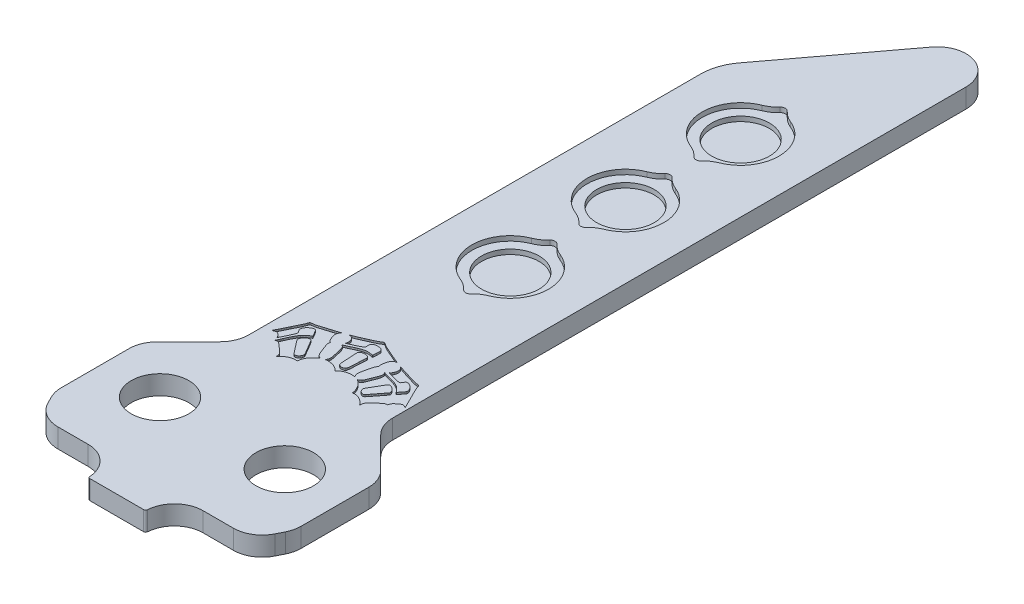
from build123d import *
from OCP.BRepFilletAPI import BRepFilletAPI_MakeFillet

# Parameters (mm, degrees)
BOSS_EXTRUDE1_DEPTH     = 1
CUT_EXTRUDE2_DEPTH      = 91.869411795
CUT_EXTRUDE2_DEPTH_BACK = 91.869411795
SKETCH2_R               = 3
SKETCH4_R               = 3
CUT_EXTRUDE4_DEPTH      = 91.869411795
CUT_EXTRUDE5_START      = 0.5
SKETCH4_3_R             = 4
SKETCH4_3_R_2           = 3
CUT_EXTRUDE5_DEPTH      = 0.5
FILLET7_R               = 0.5
LPATTERN2_COUNT         = 3
LPATTERN2_PITCH         = 12
FILLET7_OF_LPATTERN2_R  = 0.5
FILLET2_R               = 3
FILLET3_R1              = 5
FILLET3_R2              = 3
FILLET6_R               = 0.2
FILLET1_R               = 3
CUT_EXTRUDE8_START      = 1
CUT_EXTRUDE8_DEPTH      = 0.2


with BuildPart() as part:
    # Sketch1 → Boss-Extrude1 (new, symmetric)
    with BuildSketch(Plane(origin=(0, 0, 0), x_dir=(1, 0, 0), z_dir=(0, 1, 0))):
        Polygon((-7.5, 70), (7.5, 90), (7.5, 20), (12.5, 15), (12.5, 6), (11, 3), (3, 3), (3, 0), (-3, 0), (-3, 3), (-11, 3), (-12.5, 6), (-12.5, 15), (-7.5, 20), align=None)
    extrude(amount=BOSS_EXTRUDE1_DEPTH, both=True)

    # Sketch2 → Cut-Extrude2 (cut, two sides: drawn at the far end of the back side and taken through both)
    with BuildSketch(Plane(origin=(0, 0, 0), x_dir=(1, 0, 0), z_dir=(0, 1, 0)).offset(-CUT_EXTRUDE2_DEPTH_BACK)):
        with Locations(Location((-6.5, 11, 0), (0, 0, 270))):
            Circle(SKETCH2_R)
        with Locations(Location((6.5, 11, 0), (0, 0, 270))):
            Circle(SKETCH2_R)
    extrude(amount=CUT_EXTRUDE2_DEPTH + CUT_EXTRUDE2_DEPTH_BACK, mode=Mode.SUBTRACT)

    # Sketch4 → Cut-Extrude4 (cut, through all)
    with BuildSketch(Plane(origin=(0, 0, 0), x_dir=(1, 0, 0), z_dir=(0, 1, 0))):
        with Locations(Location((0, 65, 0), (0, 0, 270))):
            Circle(SKETCH4_R)
    cut_extrude4 = extrude(amount=CUT_EXTRUDE4_DEPTH, mode=Mode.SUBTRACT)

    # Sketch4<3> → Cut-Extrude5 (cut)
    # profile 1 of 3: a face of its own
    with BuildSketch(Plane(origin=(0, 0, 0), x_dir=(1, 0, 0), z_dir=(0, 1, 0)).offset(CUT_EXTRUDE5_START)):
        with BuildLine():
            ThreePointArc((-1.484614978, 68.714285714), (0, 69), (1.484614978, 68.714285714))
            ThreePointArc((1.484614978, 68.714285714), (0.634115199, 69.232213162), (0, 70))
            ThreePointArc((0, 70), (-0.634115199, 69.232213162), (-1.484614978, 68.714285714))
        make_face()
    # profile 2 of 3: a face of its own
    with BuildSketch(Plane(origin=(0, 0, 0), x_dir=(1, 0, 0), z_dir=(0, 1, 0)).offset(CUT_EXTRUDE5_START)):
        with Locations((0, 65)):
            Circle(SKETCH4_3_R)
        with Locations(Location((0, 65, 0), (0, 0, 90))):
            Circle(SKETCH4_3_R_2, mode=Mode.SUBTRACT)
    # profile 3 of 3: a face of its own
    with BuildSketch(Plane(origin=(0, 0, 0), x_dir=(1, 0, 0), z_dir=(0, 1, 0)).offset(CUT_EXTRUDE5_START)):
        with BuildLine():
            ThreePointArc((0, 60), (0.634115199, 60.767786838), (1.484614978, 61.285714286))
            ThreePointArc((1.484614978, 61.285714286), (0, 61), (-1.484614978, 61.285714286))
            ThreePointArc((-1.484614978, 61.285714286), (-0.634115199, 60.767786838), (0, 60))
        make_face()
    cut_extrude5 = extrude(amount=CUT_EXTRUDE5_DEPTH, mode=Mode.SUBTRACT)

    # Fillet7
    fillet7_edges = [part.edges().sort_by_distance(p)[0] for p in [
        (0, 0.75, -60),
        (0, 0.75, -70),
    ]]
    fillet(fillet7_edges, radius=FILLET7_R)

    # LPattern2: Cut-Extrude4, Cut-Extrude5 ×3
    with Locations(*[(0, 0, i * LPATTERN2_PITCH) for i in range(1, LPATTERN2_COUNT)]):
        add(cut_extrude4, mode=Mode.SUBTRACT)
        add(cut_extrude5, mode=Mode.SUBTRACT)

    # Fillet7 of LPattern2
    fillet7_of_lpattern2_edges = [part.edges().sort_by_distance(p)[0] for p in [
        (0, 0.75, -48),
        (0, 0.75, -58),
        (0, 0.75, -36),
        (0, 0.75, -46),
    ]]
    fillet(fillet7_of_lpattern2_edges, radius=FILLET7_OF_LPATTERN2_R)

    # Fillet2
    fillet2_edges = [part.edges().sort_by_distance(p)[0] for p in [
        (-7.5, 0, -20),
        (-12.5, 0, -15),
        (-12.5, 0, -6),
        (-11, 0, -3),
        (11, 0, -3),
        (12.5, 0, -6),
        (12.5, 0, -15),
        (7.5, 0, -20),
    ]]
    fillet(fillet2_edges, radius=FILLET2_R)

    # Fillet3: one fillet with a radius per group of edges: ONE call of the kernel's fillet builder (fillet() takes one radius for all edges)
    fillet3_edges_1 = [part.edges().sort_by_distance(p)[0] for p in [
        (-7.5, 0, -70),
    ]]
    fillet3_edges_2 = [part.edges().sort_by_distance(p)[0] for p in [
        (7.5, 0, -90),
    ]]
    fillet3 = BRepFilletAPI_MakeFillet(part.part.solid().wrapped)
    for e in fillet3_edges_1:
        fillet3.Add(FILLET3_R1, e.wrapped)
    for e in fillet3_edges_2:
        fillet3.Add(FILLET3_R2, e.wrapped)
    add(Compound.cast(fillet3.Shape()), mode=Mode.REPLACE)

    # Fillet6
    fillet6_edges = [part.edges().sort_by_distance(p)[0] for p in [
        (-3, 0, 0),
        (3, 0, 0),
    ]]
    fillet(fillet6_edges, radius=FILLET6_R)

    # Fillet1
    fillet1_edges = [part.edges().sort_by_distance(p)[0] for p in [
        (3, 0, -3),
        (-3, 0, -3),
    ]]
    fillet(fillet1_edges, radius=FILLET1_R)

    # Sketch9 → Cut-Extrude8 (cut)
    # profile 1 of 3: a face of its own
    with BuildSketch(Plane(origin=(0, 0, 0), x_dir=(1, 0, 0), z_dir=(0, 1, 0)).offset(CUT_EXTRUDE8_START)):
        with BuildLine():
            Line((2.090466235, 25.090971751), (2.155619575, 25.14832202))
            Line((2.155619575, 25.14832202), (2.125319858, 25.227637184))
            ThreePointArc((2.125319858, 25.227637184), (2.108063654, 25.280121783), (2.095837376, 25.33400061))
            ThreePointArc((2.095837376, 25.33400061), (2.088453235, 25.389881035), (2.086065745, 25.44619664))
            ThreePointArc((2.086065745, 25.44619664), (2.088571699, 25.512961864), (2.095791646, 25.57938285))
            ThreePointArc((2.095791646, 25.57938285), (2.109744606, 25.666111982), (2.126441077, 25.752354984))
            ThreePointArc((2.126441077, 25.752354984), (2.151926483, 25.866926225), (2.180105336, 25.980864926))
            ThreePointArc((2.180105336, 25.980864926), (2.203288472, 26.059156543), (2.231683915, 26.135711973))
            ThreePointArc((2.231683915, 26.135711973), (2.258454025, 26.193078634), (2.290575685, 26.247629268))
            ThreePointArc((2.290575685, 26.247629268), (2.325377942, 26.294227478), (2.365637112, 26.336201153))
            ThreePointArc((2.365637112, 26.336201153), (2.395135103, 26.360757887), (2.426957585, 26.382217017))
            ThreePointArc((2.426957585, 26.382217017), (2.465217448, 26.403556735), (2.504840473, 26.422244074))
            ThreePointArc((2.504840473, 26.422244074), (2.547060992, 26.438788871), (2.590285549, 26.452498003))
            ThreePointArc((2.590285549, 26.452498003), (2.632060498, 26.462497008), (2.674487782, 26.469209095))
            ThreePointArc((2.674487782, 26.469209095), (2.687668032, 26.47098806), (2.700783406, 26.473195011))
            ThreePointArc((2.700783406, 26.473195011), (2.710934905, 26.475428921), (2.720913379, 26.478339822))
            ThreePointArc((2.720913379, 26.478339822), (2.72701009, 26.480716259), (2.732813837, 26.483738486))
            ThreePointArc((2.732813837, 26.483738486), (2.734276698, 26.486011331), (2.733331314, 26.488543531))
            ThreePointArc((2.733331314, 26.488543531), (2.728519983, 26.492274427), (2.723122412, 26.495091289))
            ThreePointArc((2.723122412, 26.495091289), (2.68159768, 26.512202202), (2.640044464, 26.529243827))
            ThreePointArc((2.640044464, 26.529243827), (2.592090458, 26.548708022), (2.544028743, 26.567904717))
            ThreePointArc((2.544028743, 26.567904717), (2.488218008, 26.589900618), (2.432328711, 26.611696128))
            ThreePointArc((2.432328711, 26.611696128), (2.366115376, 26.637688485), (2.300113739, 26.664213801))
            ThreePointArc((2.300113739, 26.664213801), (2.220305945, 26.696873908), (2.140647779, 26.729897279))
            ThreePointArc((2.140647779, 26.729897279), (2.060454505, 26.763570962), (1.98041514, 26.797608853))
            ThreePointArc((1.98041514, 26.797608853), (1.912841147, 26.826826106), (1.845487111, 26.85654691))
            ThreePointArc((1.845487111, 26.85654691), (1.750581944, 26.898757861), (1.655609362, 26.940816909))
            ThreePointArc((1.655609362, 26.940816909), (1.580192816, 26.974000628), (1.504671458, 27.006945111))
            ThreePointArc((1.504671458, 27.006945111), (1.422561779, 27.042474632), (1.340354563, 27.077777889))
            ThreePointArc((1.340354563, 27.077777889), (1.220391923, 27.129033717), (1.10038177, 27.180178198))
            ThreePointArc((1.10038177, 27.180178198), (1.01118139, 27.219427085), (0.922958384, 27.260826167))
            ThreePointArc((0.922958384, 27.260826167), (0.828233733, 27.307800114), (0.734418017, 27.356564063))
            ThreePointArc((0.734418017, 27.356564063), (0.648206754, 27.403486316), (0.56291133, 27.45205349))
            ThreePointArc((0.56291133, 27.45205349), (0.501971734, 27.48952566), (0.44290856, 27.529890737))
            ThreePointArc((0.44290856, 27.529890737), (0.390416705, 27.565509082), (0.336050705, 27.598195461))
            ThreePointArc((0.336050705, 27.598195461), (0.301378991, 27.6126537), (0.264278159, 27.618544091))
            ThreePointArc((0.264278159, 27.618544091), (0.228226109, 27.615300282), (0.194179563, 27.603007797))
            ThreePointArc((0.194179563, 27.603007797), (0.143771864, 27.574863602), (0.09541553, 27.543324788))
            ThreePointArc((0.09541553, 27.543324788), (0.033826722, 27.502559175), (-0.02991695, 27.465252864))
            ThreePointArc((-0.02991695, 27.465252864), (-0.135269641, 27.408397179), (-0.241411713, 27.353029149))
            ThreePointArc((-0.241411713, 27.353029149), (-0.356270729, 27.295221157), (-0.471983333, 27.239141299))
            ThreePointArc((-0.471983333, 27.239141299), (-0.572873227, 27.19260055), (-0.67481407, 27.148409191))
            ThreePointArc((-0.67481407, 27.148409191), (-0.719503542, 27.129462001), (-0.764057904, 27.110199245))
            ThreePointArc((-0.764057904, 27.110199245), (-0.824097654, 27.083884012), (-0.884059778, 27.057392377))
            ThreePointArc((-0.884059778, 27.057392377), (-0.948210285, 27.028825839), (-1.01227745, 27.000072873))
            ThreePointArc((-1.01227745, 27.000072873), (-1.070997047, 26.973484395), (-1.12961631, 26.946675437))
            ThreePointArc((-1.12961631, 26.946675437), (-1.249841669, 26.89200233), (-1.370502493, 26.838297105))
            ThreePointArc((-1.370502493, 26.838297105), (-1.488027888, 26.787168145), (-1.605998359, 26.73707466))
            ThreePointArc((-1.605998359, 26.73707466), (-1.717365793, 26.690968966), (-1.829156644, 26.645899619))
            ThreePointArc((-1.829156644, 26.645899619), (-1.930702361, 26.606243609), (-2.032737438, 26.567864254))
            ThreePointArc((-2.032737438, 26.567864254), (-2.100835086, 26.542492011), (-2.168771282, 26.516690581))
            ThreePointArc((-2.168771282, 26.516690581), (-2.196132596, 26.505142795), (-2.222666051, 26.491802306))
            ThreePointArc((-2.222666051, 26.491802306), (-2.226302751, 26.486487263), (-2.224135811, 26.480422641))
            ThreePointArc((-2.224135811, 26.480422641), (-2.215848758, 26.47514582), (-2.206199247, 26.473300012))
            ThreePointArc((-2.206199247, 26.473300012), (-2.162046489, 26.470488967), (-2.118606712, 26.462101255))
            ThreePointArc((-2.118606712, 26.462101255), (-2.066940898, 26.446696986), (-2.01649576, 26.427672374))
            ThreePointArc((-2.01649576, 26.427672374), (-1.967367892, 26.405053104), (-1.919963324, 26.379014945))
            ThreePointArc((-1.919963324, 26.379014945), (-1.882987009, 26.353742094), (-1.849412582, 26.324098836))
            ThreePointArc((-1.849412582, 26.324098836), (-1.824069417, 26.295326175), (-1.802576284, 26.263574209))
            ThreePointArc((-1.802576284, 26.263574209), (-1.774430095, 26.21344885), (-1.748299979, 26.16224361))
            ThreePointArc((-1.748299979, 26.16224361), (-1.723378698, 26.10811024), (-1.700699423, 26.052999965))
            ThreePointArc((-1.700699423, 26.052999965), (-1.685491172, 26.008428264), (-1.67399037, 25.962759249))
            ThreePointArc((-1.67399037, 25.962759249), (-1.665909992, 25.915994004), (-1.661076979, 25.868782538))
            ThreePointArc((-1.661076979, 25.868782538), (-1.658456057, 25.812599486), (-1.658180241, 25.756356011))
            ThreePointArc((-1.658180241, 25.756356011), (-1.660063924, 25.703693077), (-1.664031081, 25.651146007))
            ThreePointArc((-1.664031081, 25.651146007), (-1.669607695, 25.618719537), (-1.679977196, 25.587493778))
            ThreePointArc((-1.679977196, 25.587493778), (-1.683959868, 25.577378616), (-1.687520766, 25.567107385))
            ThreePointArc((-1.687520766, 25.567107385), (-1.689914176, 25.558614602), (-1.691649944, 25.549963424))
            ThreePointArc((-1.691649944, 25.549963424), (-1.692293185, 25.543962697), (-1.692299358, 25.537927596))
            ThreePointArc((-1.692299358, 25.537927596), (-1.691130352, 25.535389314), (-1.688534887, 25.534353452))
            ThreePointArc((-1.688534887, 25.534353452), (-1.669089209, 25.536381234), (-1.650480263, 25.542377352))
            ThreePointArc((-1.650480263, 25.542377352), (-1.494819236, 25.611203708), (-1.339254028, 25.680246367))
            ThreePointArc((-1.339254028, 25.680246367), (-1.189065968, 25.747596546), (-1.03930642, 25.81589426))
            ThreePointArc((-1.03930642, 25.81589426), (-0.919072475, 25.872058651), (-0.79951791, 25.929655059))
            ThreePointArc((-0.79951791, 25.929655059), (-0.740446252, 25.958964111), (-0.681709606, 25.988938898))
            ThreePointArc((-0.681709606, 25.988938898), (-0.625850014, 26.01830261), (-0.570373665, 26.048384104))
            ThreePointArc((-0.570373665, 26.048384104), (-0.523638533, 26.074476612), (-0.477213735, 26.101117367))
            ThreePointArc((-0.477213735, 26.101117367), (-0.453793491, 26.115887594), (-0.431490118, 26.132295733))
            ThreePointArc((-0.431490118, 26.132295733), (-0.396146313, 26.162744271), (-0.363418635, 26.195988777))
            ThreePointArc((-0.363418635, 26.195988777), (-0.343748714, 26.223025866), (-0.330303589, 26.253638585))
            ThreePointArc((-0.330303589, 26.253638585), (-0.321458955, 26.291729615), (-0.318649501, 26.330732963))
            ThreePointArc((-0.318649501, 26.330732963), (-0.320152952, 26.401860602), (-0.323777426, 26.472911743))
            ThreePointArc((-0.323777426, 26.472911743), (-0.327416996, 26.549148667), (-0.328282492, 26.625467511))
            ThreePointArc((-0.328282492, 26.625467511), (-0.324269462, 26.669299937), (-0.312944741, 26.711833884))
            ThreePointArc((-0.312944741, 26.711833884), (-0.296266392, 26.745528275), (-0.272348066, 26.774535048))
            ThreePointArc((-0.272348066, 26.774535048), (-0.234136617, 26.807925264), (-0.19289319, 26.837488774))
            ThreePointArc((-0.19289319, 26.837488774), (-0.146751529, 26.864941134), (-0.098702355, 26.888898636))
            ThreePointArc((-0.098702355, 26.888898636), (-0.051373998, 26.907923566), (-0.002579491, 26.922790221))
            ThreePointArc((-0.002579491, 26.922790221), (0.050900495, 26.934362274), (0.105125675, 26.941686975))
            ThreePointArc((0.105125675, 26.941686975), (0.169885063, 26.946301185), (0.23479041, 26.9478391))
            ThreePointArc((0.23479041, 26.9478391), (0.341121437, 26.94319707), (0.446644203, 26.929312496))
            ThreePointArc((0.446644203, 26.929312496), (0.53816066, 26.907185728), (0.626184371, 26.873768936))
            ThreePointArc((0.626184371, 26.873768936), (0.694277341, 26.836280514), (0.755753612, 26.788712642))
            ThreePointArc((0.755753612, 26.788712642), (0.795705769, 26.740286509), (0.82016316, 26.682466951))
            ThreePointArc((0.82016316, 26.682466951), (0.827084821, 26.644260766), (0.828131383, 26.605446764))
            ThreePointArc((0.828131383, 26.605446764), (0.819242296, 26.43181575), (0.809667439, 26.258221201))
            ThreePointArc((0.809667439, 26.258221201), (0.799137549, 26.076988045), (0.788260074, 25.895775417))
            ThreePointArc((0.788260074, 25.895775417), (0.783826587, 25.877816922), (0.773316827, 25.862594953))
            ThreePointArc((0.773316827, 25.862594953), (0.769459482, 25.860180097), (0.764934734, 25.859692963))
            ThreePointArc((0.764934734, 25.859692963), (0.743560315, 25.862359886), (0.722215526, 25.865254417))
            ThreePointArc((0.722215526, 25.865254417), (0.696759465, 25.869124591), (0.671392608, 25.873541823))
            ThreePointArc((0.671392608, 25.873541823), (0.64211725, 25.879175846), (0.6129231, 25.885216582))
            ThreePointArc((0.6129231, 25.885216582), (0.498318835, 25.906255075), (0.382675153, 25.920513226))
            ThreePointArc((0.382675153, 25.920513226), (0.275669677, 25.926450902), (0.168521395, 25.924289068))
            ThreePointArc((0.168521395, 25.924289068), (0.060039972, 25.91395455), (-0.047380431, 25.895627563))
            ThreePointArc((-0.047380431, 25.895627563), (-0.166046032, 25.8675377), (-0.283060317, 25.833212455))
            ThreePointArc((-0.283060317, 25.833212455), (-0.368763493, 25.804580899), (-0.453838543, 25.774133629))
            ThreePointArc((-0.453838543, 25.774133629), (-0.534725125, 25.743097368), (-0.614839563, 25.710119113))
            ThreePointArc((-0.614839563, 25.710119113), (-0.718965279, 25.664832622), (-0.822382873, 25.617951576))
            ThreePointArc((-0.822382873, 25.617951576), (-0.998146826, 25.536274563), (-1.17362943, 25.453994811))
            ThreePointArc((-1.17362943, 25.453994811), (-1.266919239, 25.410179819), (-1.360302599, 25.366564567))
            ThreePointArc((-1.360302599, 25.366564567), (-1.443361131, 25.328033596), (-1.52653672, 25.289755966))
            ThreePointArc((-1.52653672, 25.289755966), (-1.59692883, 25.257562627), (-1.66737486, 25.225487451))
            ThreePointArc((-1.66737486, 25.225487451), (-1.686241896, 25.217426486), (-1.70545463, 25.210228219))
            ThreePointArc((-1.70545463, 25.210228219), (-1.726578068, 25.20246517), (-1.747436178, 25.194015092))
            ThreePointArc((-1.747436178, 25.194015092), (-1.75399557, 25.189275819), (-1.757849051, 25.18215985))
            ThreePointArc((-1.757849051, 25.18215985), (-1.757160163, 25.17586061), (-1.752314284, 25.171777419))
            ThreePointArc((-1.752314284, 25.171777419), (-1.735620573, 25.166816507), (-1.718655573, 25.162882118))
            ThreePointArc((-1.718655573, 25.162882118), (-1.687287589, 25.153713217), (-1.657980142, 25.139253176))
            ThreePointArc((-1.657980142, 25.139253176), (-1.626417979, 25.117662434), (-1.597398063, 25.092759124))
            ThreePointArc((-1.597398063, 25.092759124), (-1.567681273, 25.061406389), (-1.541130488, 25.027330922))
            ThreePointArc((-1.541130488, 25.027330922), (-1.515704703, 24.988124601), (-1.493348275, 24.947090515))
            ThreePointArc((-1.493348275, 24.947090515), (-1.468633212, 24.89311583), (-1.447334729, 24.837703959))
            ThreePointArc((-1.447334729, 24.837703959), (-1.4252904, 24.770540713), (-1.405758249, 24.702604352))
            ThreePointArc((-1.405758249, 24.702604352), (-1.378277948, 24.595994378), (-1.352740411, 24.488902419))
            ThreePointArc((-1.352740411, 24.488902419), (-1.30316183, 24.27095534), (-1.25416229, 24.052877349))
            ThreePointArc((-1.25416229, 24.052877349), (-1.219113002, 23.89485475), (-1.184513904, 23.736732971))
            ThreePointArc((-1.184513904, 23.736732971), (-1.170399367, 23.667487525), (-1.158077849, 23.597900656))
            ThreePointArc((-1.158077849, 23.597900656), (-1.151609472, 23.550167307), (-1.147788711, 23.502149453))
            ThreePointArc((-1.147788711, 23.502149453), (-1.14632957, 23.451089134), (-1.147239208, 23.400016069))
            ThreePointArc((-1.147239208, 23.400016069), (-1.150737631, 23.347754548), (-1.156931395, 23.29574356))
            ThreePointArc((-1.156931395, 23.29574356), (-1.165085448, 23.253469964), (-1.177103268, 23.212128491))
            ThreePointArc((-1.177103268, 23.212128491), (-1.192621043, 23.172894809), (-1.211795261, 23.135312466))
            ThreePointArc((-1.211795261, 23.135312466), (-1.23769012, 23.09294945), (-1.266023752, 23.052177228))
            ThreePointArc((-1.266023752, 23.052177228), (-1.271718669, 23.044208067), (-1.277152954, 23.036058948))
            ThreePointArc((-1.277152954, 23.036058948), (-1.28152298, 23.028874944), (-1.285521638, 23.021477798))
            ThreePointArc((-1.285521638, 23.021477798), (-1.288345953, 23.015589504), (-1.290898017, 23.009578205))
            ThreePointArc((-1.290898017, 23.009578205), (-1.291104552, 23.007185698), (-1.289955608, 23.005076983))
            ThreePointArc((-1.289955608, 23.005076983), (-1.287516135, 23.003524943), (-1.284653508, 23.003118458))
            ThreePointArc((-1.284653508, 23.003118458), (-1.273223624, 23.004022899), (-1.261808014, 23.005092535))
            ThreePointArc((-1.261808014, 23.005092535), (-1.248057207, 23.00665564), (-1.234349887, 23.008562822))
            ThreePointArc((-1.234349887, 23.008562822), (-1.218638796, 23.011082865), (-1.20297151, 23.013862281))
            ThreePointArc((-1.20297151, 23.013862281), (-1.118453537, 23.02505219), (-1.033229587, 23.027371727))
            ThreePointArc((-1.033229587, 23.027371727), (-0.918021979, 23.021996446), (-0.803154465, 23.01164556))
            ThreePointArc((-0.803154465, 23.01164556), (-0.685618493, 22.995893338), (-0.56887807, 22.975048416))
            ThreePointArc((-0.56887807, 22.975048416), (-0.474591161, 22.952194227), (-0.38239429, 22.921993695))
            ThreePointArc((-0.38239429, 22.921993695), (-0.3037284, 22.890060788), (-0.227095801, 22.853516602))
            ThreePointArc((-0.227095801, 22.853516602), (-0.14772014, 22.810230553), (-0.070568406, 22.763094713))
            ThreePointArc((-0.070568406, 22.763094713), (0.000581076, 22.714592714), (0.069185236, 22.662552711))
            ThreePointArc((0.069185236, 22.662552711), (0.123132983, 22.615432154), (0.172763145, 22.563783793))
            ThreePointArc((0.172763145, 22.563783793), (0.184701174, 22.550814428), (0.197203792, 22.538388428))
            ThreePointArc((0.197203792, 22.538388428), (0.209490101, 22.527322734), (0.222354107, 22.516934262))
            ThreePointArc((0.222354107, 22.516934262), (0.23345767, 22.508919373), (0.244980386, 22.501519738))
            ThreePointArc((0.244980386, 22.501519738), (0.252005603, 22.498485103), (0.259587651, 22.497448172))
            ThreePointArc((0.259587651, 22.497448172), (0.267156066, 22.498506372), (0.274144007, 22.501599812))
            ThreePointArc((0.274144007, 22.501599812), (0.284299818, 22.508436157), (0.293925352, 22.516000891))
            ThreePointArc((0.293925352, 22.516000891), (0.305187754, 22.526197897), (0.315755258, 22.537113412))
            ThreePointArc((0.315755258, 22.537113412), (0.3269081, 22.550010921), (0.337447579, 22.563414317))
            ThreePointArc((0.337447579, 22.563414317), (0.376021853, 22.609792352), (0.419097932, 22.652022059))
            ThreePointArc((0.419097932, 22.652022059), (0.473733383, 22.697435875), (0.531096901, 22.739350955))
            ThreePointArc((0.531096901, 22.739350955), (0.597513448, 22.7820481), (0.666251157, 22.820898214))
            ThreePointArc((0.666251157, 22.820898214), (0.741346638, 22.858315214), (0.818132336, 22.892128226))
            ThreePointArc((0.818132336, 22.892128226), (0.909310869, 22.925686387), (1.002796276, 22.952146805))
            ThreePointArc((1.002796276, 22.952146805), (1.114250769, 22.976316696), (1.226731275, 22.995142826))
            ThreePointArc((1.226731275, 22.995142826), (1.34125764, 23.008748855), (1.45630054, 23.016906287))
            ThreePointArc((1.45630054, 23.016906287), (1.557492532, 23.018123205), (1.658521402, 23.012252281))
            ThreePointArc((1.658521402, 23.012252281), (1.685276218, 23.009842986), (1.712046227, 23.007608823))
            ThreePointArc((1.712046227, 23.007608823), (1.734963615, 23.005891736), (1.757897643, 23.004413398))
            ThreePointArc((1.757897643, 23.004413398), (1.777783734, 23.003264296), (1.797673062, 23.002172631))
            ThreePointArc((1.797673062, 23.002172631), (1.800000335, 23.002520223), (1.802004481, 23.003753274))
            ThreePointArc((1.802004481, 23.003753274), (1.802911892, 23.005479202), (1.802556919, 23.007396548))
            ThreePointArc((1.802556919, 23.007396548), (1.797462619, 23.016227484), (1.792251761, 23.024990147))
            ThreePointArc((1.792251761, 23.024990147), (1.785711202, 23.035513355), (1.778899442, 23.045863076))
            ThreePointArc((1.778899442, 23.045863076), (1.770612898, 23.057896828), (1.762135886, 23.069797176))
            ThreePointArc((1.762135886, 23.069797176), (1.720589915, 23.136629811), (1.688881843, 23.208652496))
            ThreePointArc((1.688881843, 23.208652496), (1.667321425, 23.28504868), (1.656462747, 23.363682755))
            ThreePointArc((1.656462747, 23.363682755), (1.654619961, 23.462833931), (1.662629234, 23.561678269))
            ThreePointArc((1.662629234, 23.561678269), (1.683535404, 23.701539135), (1.709408579, 23.840566861))
            ThreePointArc((1.709408579, 23.840566861), (1.775738921, 24.159915), (1.843977124, 24.478860913))
            ThreePointArc((1.843977124, 24.478860913), (1.881230175, 24.634957072), (1.924853506, 24.789394132))
            ThreePointArc((1.924853506, 24.789394132), (1.957668859, 24.882391614), (1.99842572, 24.972192825))
            ThreePointArc((1.99842572, 24.972192825), (2.038793882, 25.035962036), (2.090466235, 25.090971751))
        make_face()
        with BuildLine():
            ThreePointArc((0.544518731, 25.52298008), (0.486627033, 25.542327264), (0.427436878, 25.557236577))
            ThreePointArc((0.427436878, 25.557236577), (0.361570156, 25.568463844), (0.295016437, 25.574386612))
            ThreePointArc((0.295016437, 25.574386612), (0.231429853, 25.57453198), (0.168103799, 25.568779972))
            ThreePointArc((0.168103799, 25.568779972), (0.105920519, 25.557223701), (0.045087026, 25.539914921))
            ThreePointArc((0.045087026, 25.539914921), (-0.016404674, 25.516391472), (-0.075737835, 25.487858021))
            ThreePointArc((-0.075737835, 25.487858021), (-0.125894465, 25.457317514), (-0.172233608, 25.421246835))
            ThreePointArc((-0.172233608, 25.421246835), (-0.201682024, 25.387920053), (-0.221698501, 25.348205771))
            ThreePointArc((-0.221698501, 25.348205771), (-0.235523046, 25.294993007), (-0.240227482, 25.240215414))
            ThreePointArc((-0.240227482, 25.240215414), (-0.238791944, 25.138885349), (-0.23419921, 25.03764924))
            ThreePointArc((-0.23419921, 25.03764924), (-0.205092854, 24.562683459), (-0.175717672, 24.087734229))
            ThreePointArc((-0.175717672, 24.087734229), (-0.162272182, 23.879927736), (-0.147763736, 23.672192749))
            ThreePointArc((-0.147763736, 23.672192749), (-0.138416417, 23.548007421), (-0.128363633, 23.42387721))
            ThreePointArc((-0.128363633, 23.42387721), (-0.123097793, 23.391999078), (-0.112816982, 23.361368222))
            ThreePointArc((-0.112816982, 23.361368222), (-0.070421903, 23.292934911), (-0.009616412, 23.240179314))
            ThreePointArc((-0.009616412, 23.240179314), (0.073264418, 23.198696811), (0.162725454, 23.174473829))
            ThreePointArc((0.162725454, 23.174473829), (0.260603398, 23.167470026), (0.358084348, 23.178722122))
            ThreePointArc((0.358084348, 23.178722122), (0.445948674, 23.207739387), (0.525279452, 23.255370985))
            ThreePointArc((0.525279452, 23.255370985), (0.55757836, 23.285585125), (0.583197754, 23.321637314))
            ThreePointArc((0.583197754, 23.321637314), (0.603392549, 23.364857308), (0.616420882, 23.410749138))
            ThreePointArc((0.616420882, 23.410749138), (0.629648197, 23.489445611), (0.638157964, 23.568790936))
            ThreePointArc((0.638157964, 23.568790936), (0.652934673, 23.76733392), (0.666635069, 23.965954078))
            ThreePointArc((0.666635069, 23.965954078), (0.686460259, 24.268506013), (0.705846123, 24.571086416))
            ThreePointArc((0.705846123, 24.571086416), (0.718574481, 24.779095832), (0.730412031, 24.987157844))
            ThreePointArc((0.730412031, 24.987157844), (0.738899064, 25.144741697), (0.74710653, 25.302340359))
            ThreePointArc((0.74710653, 25.302340359), (0.746548205, 25.326487416), (0.742422771, 25.350286007))
            ThreePointArc((0.742422771, 25.350286007), (0.729214254, 25.384834635), (0.708216801, 25.41528426))
            ThreePointArc((0.708216801, 25.41528426), (0.676195184, 25.447037969), (0.6402382, 25.474255195))
            ThreePointArc((0.6402382, 25.474255195), (0.593725124, 25.501263132), (0.544518731, 25.52298008))
        make_face(mode=Mode.SUBTRACT)
    # profile 2 of 3: a face of its own
    with BuildSketch(Plane(origin=(0, 0, 0), x_dir=(1, 0, 0), z_dir=(0, 1, 0)).offset(CUT_EXTRUDE8_START)):
        with BuildLine():
            Line((-4.060024482, 24.511803985), (-4.03247554, 24.464878693))
            Line((-4.03247554, 24.464878693), (-4.110501852, 24.425639427))
            ThreePointArc((-4.110501852, 24.425639427), (-4.200901583, 24.376331054), (-4.287810599, 24.321101988))
            ThreePointArc((-4.287810599, 24.321101988), (-4.379873678, 24.254757064), (-4.468510116, 24.18389917))
            ThreePointArc((-4.468510116, 24.18389917), (-4.552929112, 24.109192602), (-4.63349626, 24.030347356))
            ThreePointArc((-4.63349626, 24.030347356), (-4.701093042, 23.955717397), (-4.763283615, 23.876525932))
            ThreePointArc((-4.763283615, 23.876525932), (-4.832872196, 23.776172953), (-4.897506437, 23.672559701))
            ThreePointArc((-4.897506437, 23.672559701), (-4.975673373, 23.536611988), (-5.050656074, 23.398882379))
            ThreePointArc((-5.050656074, 23.398882379), (-5.132625536, 23.239995373), (-5.21119924, 23.079401954))
            ThreePointArc((-5.21119924, 23.079401954), (-5.291686447, 22.906484896), (-5.369133074, 22.732184812))
            ThreePointArc((-5.369133074, 22.732184812), (-5.392286352, 22.679183431), (-5.415703077, 22.626297916))
            ThreePointArc((-5.415703077, 22.626297916), (-5.442190434, 22.567159188), (-5.468887094, 22.508114649))
            ThreePointArc((-5.468887094, 22.508114649), (-5.494555354, 22.451878785), (-5.52042455, 22.395735069))
            ThreePointArc((-5.52042455, 22.395735069), (-5.540662778, 22.352451684), (-5.561230492, 22.309323891))
            ThreePointArc((-5.561230492, 22.309323891), (-5.577958354, 22.274489878), (-5.594608355, 22.239618582))
            ThreePointArc((-5.594608355, 22.239618582), (-5.608718116, 22.209844914), (-5.622720958, 22.180020812))
            Line((-5.622720958, 22.180020812), (-5.647372677, 22.127187947))
            ThreePointArc((-5.647372677, 22.127187947), (-5.648062875, 22.125152901), (-5.64829663, 22.12301675))
            ThreePointArc((-5.64829663, 22.12301675), (-5.647721646, 22.121849839), (-5.646446011, 22.121594804))
            ThreePointArc((-5.646446011, 22.121594804), (-5.639880076, 22.123414657), (-5.633351389, 22.125363911))
            ThreePointArc((-5.633351389, 22.125363911), (-5.625099864, 22.128055279), (-5.616934333, 22.130997253))
            ThreePointArc((-5.616934333, 22.130997253), (-5.607143113, 22.134792126), (-5.597419209, 22.138756311))
            ThreePointArc((-5.597419209, 22.138756311), (-5.584852178, 22.143387869), (-5.571936053, 22.14693122))
            ThreePointArc((-5.571936053, 22.14693122), (-5.554196893, 22.150664547), (-5.536337068, 22.153769729))
            ThreePointArc((-5.536337068, 22.153769729), (-5.516926021, 22.1564497), (-5.497433871, 22.158456452))
            ThreePointArc((-5.497433871, 22.158456452), (-5.479195996, 22.159624629), (-5.4609249, 22.160014252))
            ThreePointArc((-5.4609249, 22.160014252), (-5.399616897, 22.154316111), (-5.340409128, 22.137416992))
            ThreePointArc((-5.340409128, 22.137416992), (-5.276019447, 22.107750914), (-5.215721119, 22.070465276))
            ThreePointArc((-5.215721119, 22.070465276), (-5.123024504, 22.001339599), (-5.034033727, 21.927504221))
            ThreePointArc((-5.034033727, 21.927504221), (-4.841113175, 21.757763352), (-4.649236408, 21.586843465))
            ThreePointArc((-4.649236408, 21.586843465), (-4.530406054, 21.479736851), (-4.412175846, 21.371968126))
            ThreePointArc((-4.412175846, 21.371968126), (-4.353251022, 21.315997194), (-4.296351051, 21.257968981))
            ThreePointArc((-4.296351051, 21.257968981), (-4.259388733, 21.216142472), (-4.225361087, 21.17189556))
            ThreePointArc((-4.225361087, 21.17189556), (-4.195532214, 21.12676741), (-4.16916273, 21.07953435))
            ThreePointArc((-4.16916273, 21.07953435), (-4.155724354, 21.048837345), (-4.145999886, 21.016769748))
            ThreePointArc((-4.145999886, 21.016769748), (-4.135642252, 20.969347375), (-4.12721761, 20.921543739))
            ThreePointArc((-4.12721761, 20.921543739), (-4.120711485, 20.873170994), (-4.116188612, 20.824572684))
            ThreePointArc((-4.116188612, 20.824572684), (-4.115580614, 20.789846362), (-4.118777625, 20.755262172))
            ThreePointArc((-4.118777625, 20.755262172), (-4.119897819, 20.746172548), (-4.120573243, 20.737039097))
            ThreePointArc((-4.120573243, 20.737039097), (-4.120628819, 20.729420825), (-4.120043207, 20.721824891))
            ThreePointArc((-4.120043207, 20.721824891), (-4.119101941, 20.716490201), (-4.117574673, 20.71129286))
            ThreePointArc((-4.117574673, 20.71129286), (-4.115858896, 20.70910328), (-4.113170339, 20.70838927))
            ThreePointArc((-4.113170339, 20.70838927), (-4.109039751, 20.709462654), (-4.105604733, 20.711995353))
            ThreePointArc((-4.105604733, 20.711995353), (-4.093472859, 20.725302002), (-4.081492497, 20.738745222))
            ThreePointArc((-4.081492497, 20.738745222), (-4.067418023, 20.755064602), (-4.053692211, 20.771678303))
            ThreePointArc((-4.053692211, 20.771678303), (-4.038269984, 20.791029019), (-4.023120595, 20.810594073))
            ThreePointArc((-4.023120595, 20.810594073), (-3.965725608, 20.880198815), (-3.903252139, 20.945283918))
            ThreePointArc((-3.903252139, 20.945283918), (-3.825333042, 21.017124863), (-3.744145312, 21.085250187))
            ThreePointArc((-3.744145312, 21.085250187), (-3.65910857, 21.150102144), (-3.571149118, 21.210931074))
            ThreePointArc((-3.571149118, 21.210931074), (-3.491499544, 21.259415656), (-3.408655789, 21.302214271))
            ThreePointArc((-3.408655789, 21.302214271), (-3.326576865, 21.337844173), (-3.242367194, 21.36809597))
            ThreePointArc((-3.242367194, 21.36809597), (-3.153844436, 21.393838005), (-3.063955171, 21.414303862))
            ThreePointArc((-3.063955171, 21.414303862), (-2.979562145, 21.428209204), (-2.894469742, 21.43685931))
            ThreePointArc((-2.894469742, 21.43685931), (-2.825318732, 21.437707157), (-2.756535045, 21.430538791))
            ThreePointArc((-2.756535045, 21.430538791), (-2.715744338, 21.424886907), (-2.674727873, 21.421216064))
            ThreePointArc((-2.674727873, 21.421216064), (-2.655188694, 21.423393605), (-2.637598933, 21.432175493))
            ThreePointArc((-2.637598933, 21.432175493), (-2.624387314, 21.446368403), (-2.617097769, 21.464336378))
            ThreePointArc((-2.617097769, 21.464336378), (-2.610084989, 21.503533654), (-2.605140519, 21.543045143))
            ThreePointArc((-2.605140519, 21.543045143), (-2.584137421, 21.676645012), (-2.547887446, 21.806936969))
            ThreePointArc((-2.547887446, 21.806936969), (-2.493945826, 21.944691925), (-2.42806579, 22.07715304))
            ThreePointArc((-2.42806579, 22.07715304), (-2.345472196, 22.212846484), (-2.252017359, 22.341301168))
            ThreePointArc((-2.252017359, 22.341301168), (-2.143908011, 22.468196271), (-2.02705241, 22.587085997))
            ThreePointArc((-2.02705241, 22.587085997), (-1.995707481, 22.616194966), (-1.963785105, 22.644669491))
            ThreePointArc((-1.963785105, 22.644669491), (-1.929080848, 22.674508259), (-1.89389252, 22.703774607))
            ThreePointArc((-1.89389252, 22.703774607), (-1.861047073, 22.730188972), (-1.82776822, 22.756055166))
            ThreePointArc((-1.82776822, 22.756055166), (-1.80321328, 22.77399625), (-1.777912315, 22.790868972))
            ThreePointArc((-1.777912315, 22.790868972), (-1.757915343, 22.80377823), (-1.738088481, 22.816947259))
            ThreePointArc((-1.738088481, 22.816947259), (-1.721119733, 22.828627314), (-1.70438875, 22.840645478))
            ThreePointArc((-1.70438875, 22.840645478), (-1.690498611, 22.85094028), (-1.676709442, 22.861369936))
            ThreePointArc((-1.676709442, 22.861369936), (-1.674343584, 22.864129177), (-1.673305452, 22.867612419))
            ThreePointArc((-1.673305452, 22.867612419), (-1.673769717, 22.8702698), (-1.675463988, 22.872369005))
            ThreePointArc((-1.675463988, 22.872369005), (-1.679892407, 22.87538886), (-1.684549058, 22.878043294))
            ThreePointArc((-1.684549058, 22.878043294), (-1.690872497, 22.881033008), (-1.697395843, 22.883556935))
            ThreePointArc((-1.697395843, 22.883556935), (-1.705038715, 22.885995363), (-1.71279015, 22.888062896))
            ThreePointArc((-1.71279015, 22.888062896), (-1.746551661, 22.897933301), (-1.779215338, 22.910985075))
            ThreePointArc((-1.779215338, 22.910985075), (-1.817234609, 22.929615307), (-1.854166864, 22.950316974))
            ThreePointArc((-1.854166864, 22.950316974), (-1.889466982, 22.972755351), (-1.923470642, 22.997113719))
            ThreePointArc((-1.923470642, 22.997113719), (-1.94902321, 23.018754307), (-1.97212408, 23.042994741))
            ThreePointArc((-1.97212408, 23.042994741), (-2.00175028, 23.080034588), (-2.028845871, 23.118963895))
            ThreePointArc((-2.028845871, 23.118963895), (-2.056987375, 23.164684847), (-2.082995755, 23.211652005))
            ThreePointArc((-2.082995755, 23.211652005), (-2.112468551, 23.270449101), (-2.139799308, 23.330271955))
            ThreePointArc((-2.139799308, 23.330271955), (-2.173163261, 23.408732289), (-2.205201146, 23.487743372))
            ThreePointArc((-2.205201146, 23.487743372), (-2.335603393, 23.818575581), (-2.465118543, 24.14975608))
            ThreePointArc((-2.465118543, 24.14975608), (-2.512231222, 24.276871092), (-2.555121515, 24.405472234))
            ThreePointArc((-2.555121515, 24.405472234), (-2.575406786, 24.481782353), (-2.588660188, 24.559622406))
            ThreePointArc((-2.588660188, 24.559622406), (-2.591872464, 24.626310029), (-2.585092103, 24.692729789))
            ThreePointArc((-2.585092103, 24.692729789), (-2.58191494, 24.710035513), (-2.578568097, 24.727309225))
            ThreePointArc((-2.578568097, 24.727309225), (-2.575212796, 24.743692881), (-2.571670522, 24.760037131))
            ThreePointArc((-2.571670522, 24.760037131), (-2.568526585, 24.773821239), (-2.565242024, 24.787572517))
            ThreePointArc((-2.565242024, 24.787572517), (-2.56333774, 24.794360542), (-2.56097749, 24.801003795))
            ThreePointArc((-2.56097749, 24.801003795), (-2.559759197, 24.806748859), (-2.560483986, 24.812576781))
            ThreePointArc((-2.560483986, 24.812576781), (-2.563131779, 24.818930259), (-2.567043422, 24.824593874))
            ThreePointArc((-2.567043422, 24.824593874), (-2.573739873, 24.831425288), (-2.581279627, 24.8373128))
            ThreePointArc((-2.581279627, 24.8373128), (-2.59242911, 24.844476061), (-2.603931757, 24.851057276))
            ThreePointArc((-2.603931757, 24.851057276), (-2.63706757, 24.871594093), (-2.667465826, 24.896000833))
            ThreePointArc((-2.667465826, 24.896000833), (-2.70367172, 24.930843474), (-2.737806508, 24.967717483))
            ThreePointArc((-2.737806508, 24.967717483), (-2.770853889, 25.007814859), (-2.801549859, 25.04973963))
            ThreePointArc((-2.801549859, 25.04973963), (-2.825188715, 25.087589773), (-2.845324927, 25.12741391))
            ThreePointArc((-2.845324927, 25.12741391), (-2.871884019, 25.188366124), (-2.896954473, 25.249945585))
            ThreePointArc((-2.896954473, 25.249945585), (-2.925463406, 25.324038585), (-2.952906372, 25.398532984))
            ThreePointArc((-2.952906372, 25.398532984), (-2.977937734, 25.469549905), (-3.001984727, 25.540906155))
            ThreePointArc((-3.001984727, 25.540906155), (-3.016535928, 25.588675948), (-3.028928298, 25.637050732))
            ThreePointArc((-3.028928298, 25.637050732), (-3.043487683, 25.718294825), (-3.04969759, 25.800599231))
            ThreePointArc((-3.04969759, 25.800599231), (-3.045845439, 25.871954096), (-3.030921094, 25.941836996))
            ThreePointArc((-3.030921094, 25.941836996), (-3.004547646, 26.011420022), (-2.968246397, 26.076378282))
            ThreePointArc((-2.968246397, 26.076378282), (-2.914899087, 26.150562456), (-2.85576858, 26.220224572))
            ThreePointArc((-2.85576858, 26.220224572), (-2.84509171, 26.232051534), (-2.834645187, 26.244082441))
            ThreePointArc((-2.834645187, 26.244082441), (-2.826641282, 26.253855181), (-2.819017463, 26.263927238))
            ThreePointArc((-2.819017463, 26.263927238), (-2.814043839, 26.271086477), (-2.809384033, 26.278453827))
            ThreePointArc((-2.809384033, 26.278453827), (-2.809400368, 26.280519964), (-2.811249647, 26.28144157))
            ThreePointArc((-2.811249647, 26.28144157), (-2.81617526, 26.280722888), (-2.8209873, 26.27944914))
            ThreePointArc((-2.8209873, 26.27944914), (-2.86161039, 26.266162819), (-2.902223078, 26.252844735))
            ThreePointArc((-2.902223078, 26.252844735), (-2.948682853, 26.237510738), (-2.995095735, 26.222035389))
            ThreePointArc((-2.995095735, 26.222035389), (-3.049001129, 26.203912242), (-3.10287119, 26.185684337))
            ThreePointArc((-3.10287119, 26.185684337), (-3.167747691, 26.163906677), (-3.232770266, 26.142569114))
            ThreePointArc((-3.232770266, 26.142569114), (-3.313613687, 26.116502612), (-3.394549804, 26.090725371))
            ThreePointArc((-3.394549804, 26.090725371), (-3.477491087, 26.064635061), (-3.560524674, 26.03884002))
            ThreePointArc((-3.560524674, 26.03884002), (-3.632394441, 26.016869249), (-3.70438383, 25.995293659))
            ThreePointArc((-3.70438383, 25.995293659), (-3.779379063, 25.972907025), (-3.854300102, 25.950273328))
            ThreePointArc((-3.854300102, 25.950273328), (-3.947212546, 25.92194899), (-4.040075564, 25.893463027))
            ThreePointArc((-4.040075564, 25.893463027), (-4.13506986, 25.864142768), (-4.230013289, 25.834658212))
            ThreePointArc((-4.230013289, 25.834658212), (-4.312002453, 25.808998375), (-4.39392271, 25.783119391))
            ThreePointArc((-4.39392271, 25.783119391), (-4.541531026, 25.736984262), (-4.689538621, 25.69214659))
            ThreePointArc((-4.689538621, 25.69214659), (-4.793598053, 25.662514279), (-4.898357284, 25.635459834))
            ThreePointArc((-4.898357284, 25.635459834), (-4.981286044, 25.616627002), (-5.064809608, 25.600637343))
            ThreePointArc((-5.064809608, 25.600637343), (-5.142098431, 25.58894877), (-5.219826193, 25.580667461))
            ThreePointArc((-5.219826193, 25.580667461), (-5.280725185, 25.573851058), (-5.34116143, 25.563721353))
            ThreePointArc((-5.34116143, 25.563721353), (-5.37595276, 25.552589177), (-5.407240748, 25.533736491))
            ThreePointArc((-5.407240748, 25.533736491), (-5.432991355, 25.508384008), (-5.452038754, 25.477675073))
            ThreePointArc((-5.452038754, 25.477675073), (-5.475621261, 25.422963498), (-5.495969364, 25.366968447))
            ThreePointArc((-5.495969364, 25.366968447), (-5.529597906, 25.27126563), (-5.566754931, 25.176876735))
            ThreePointArc((-5.566754931, 25.176876735), (-5.615276959, 25.063367314), (-5.666143158, 24.950888847))
            ThreePointArc((-5.666143158, 24.950888847), (-5.736347244, 24.8026974), (-5.808718511, 24.65555217))
            ThreePointArc((-5.808718511, 24.65555217), (-5.914638367, 24.445484301), (-6.021642014, 24.235966412))
            ThreePointArc((-6.021642014, 24.235966412), (-6.037611138, 24.204473065), (-6.053233957, 24.172806499))
            ThreePointArc((-6.053233957, 24.172806499), (-6.086931733, 24.103429652), (-6.120535959, 24.034007443))
            ThreePointArc((-6.120535959, 24.034007443), (-6.160333981, 23.951479992), (-6.200000239, 23.868889128))
            ThreePointArc((-6.200000239, 23.868889128), (-6.242148354, 23.780802159), (-6.284180333, 23.692659715))
            ThreePointArc((-6.284180333, 23.692659715), (-6.328529381, 23.600027907), (-6.373287242, 23.507592937))
            ThreePointArc((-6.373287242, 23.507592937), (-6.420241573, 23.411644017), (-6.467572236, 23.315880178))
            ThreePointArc((-6.467572236, 23.315880178), (-6.510497888, 23.229882059), (-6.553761867, 23.144053647))
            ThreePointArc((-6.553761867, 23.144053647), (-6.583503582, 23.086211488), (-6.613944248, 23.028734094))
            ThreePointArc((-6.613944248, 23.028734094), (-6.637002234, 22.985696622), (-6.659951089, 22.942600858))
            ThreePointArc((-6.659951089, 22.942600858), (-6.679400932, 22.905783489), (-6.698700842, 22.868887304))
            ThreePointArc((-6.698700842, 22.868887304), (-6.715678006, 22.836242172), (-6.732632184, 22.803585096))
            ThreePointArc((-6.732632184, 22.803585096), (-6.733618466, 22.800955872), (-6.73395359, 22.798167815))
            ThreePointArc((-6.73395359, 22.798167815), (-6.733205681, 22.796875285), (-6.731712369, 22.796879609))
            ThreePointArc((-6.731712369, 22.796879609), (-6.722342037, 22.80241683), (-6.713041842, 22.80807106))
            ThreePointArc((-6.713041842, 22.80807106), (-6.701474194, 22.815385309), (-6.690074886, 22.822959246))
            ThreePointArc((-6.690074886, 22.822959246), (-6.676359527, 22.832424427), (-6.662764687, 22.842061908))
            ThreePointArc((-6.662764687, 22.842061908), (-6.646278778, 22.853513493), (-6.629437659, 22.864435978))
            ThreePointArc((-6.629437659, 22.864435978), (-6.608715092, 22.877155243), (-6.587767152, 22.889499807))
            ThreePointArc((-6.587767152, 22.889499807), (-6.566396817, 22.901581484), (-6.544813193, 22.913277865))
            ThreePointArc((-6.544813193, 22.913277865), (-6.526251777, 22.922778095), (-6.507421319, 22.931733227))
            ThreePointArc((-6.507421319, 22.931733227), (-6.445934338, 22.95337761), (-6.381548094, 22.963553055))
            ThreePointArc((-6.381548094, 22.963553055), (-6.31588752, 22.962044189), (-6.251527719, 22.948952069))
            ThreePointArc((-6.251527719, 22.948952069), (-6.182777627, 22.922619641), (-6.118825272, 22.886149543))
            ThreePointArc((-6.118825272, 22.886149543), (-6.049413125, 22.834298878), (-5.98518109, 22.776154374))
            ThreePointArc((-5.98518109, 22.776154374), (-5.950505208, 22.73955124), (-5.918061523, 22.700955728))
            ThreePointArc((-5.918061523, 22.700955728), (-5.888404625, 22.660996229), (-5.861269531, 22.619283164))
            ThreePointArc((-5.861269531, 22.619283164), (-5.840120029, 22.581775867), (-5.821446606, 22.542976356))
            ThreePointArc((-5.821446606, 22.542976356), (-5.812652264, 22.515718583), (-5.80967807, 22.487232081))
            ThreePointArc((-5.80967807, 22.487232081), (-5.809471795, 22.480745489), (-5.808853793, 22.474285109))
            ThreePointArc((-5.808853793, 22.474285109), (-5.807870465, 22.468762586), (-5.806350957, 22.46336293))
            ThreePointArc((-5.806350957, 22.46336293), (-5.804765765, 22.459466236), (-5.802703502, 22.455799613))
            ThreePointArc((-5.802703502, 22.455799613), (-5.800828066, 22.454064369), (-5.798351719, 22.453435052))
            ThreePointArc((-5.798351719, 22.453435052), (-5.779166366, 22.459006708), (-5.765949906, 22.47398824))
            ThreePointArc((-5.765949906, 22.47398824), (-5.625127744, 22.773336559), (-5.484625965, 23.072835387))
            ThreePointArc((-5.484625965, 23.072835387), (-5.358066536, 23.344943792), (-5.2330127, 23.617747404))
            ThreePointArc((-5.2330127, 23.617747404), (-5.189025436, 23.723766531), (-5.152294237, 23.832512812))
            ThreePointArc((-5.152294237, 23.832512812), (-5.143297866, 23.864901295), (-5.135671303, 23.897639407))
            ThreePointArc((-5.135671303, 23.897639407), (-5.130428163, 23.926878479), (-5.126971919, 23.956382178))
            ThreePointArc((-5.126971919, 23.956382178), (-5.125703823, 23.981248805), (-5.126190642, 24.006142986))
            ThreePointArc((-5.126190642, 24.006142986), (-5.128697523, 24.02503355), (-5.134077104, 24.043314633))
            ThreePointArc((-5.134077104, 24.043314633), (-5.139170597, 24.054934816), (-5.145394036, 24.065991088))
            ThreePointArc((-5.145394036, 24.065991088), (-5.158732013, 24.086776281), (-5.172402922, 24.107344025))
            ThreePointArc((-5.172402922, 24.107344025), (-5.188971434, 24.131381452), (-5.205961356, 24.155122893))
            ThreePointArc((-5.205961356, 24.155122893), (-5.224184472, 24.179721217), (-5.242781837, 24.204037828))
            ThreePointArc((-5.242781837, 24.204037828), (-5.261333466, 24.228105134), (-5.279698648, 24.252315012))
            ThreePointArc((-5.279698648, 24.252315012), (-5.296725085, 24.275162897), (-5.313536786, 24.298169245))
            ThreePointArc((-5.313536786, 24.298169245), (-5.327506171, 24.31763784), (-5.341320068, 24.337217069))
            ThreePointArc((-5.341320068, 24.337217069), (-5.347344773, 24.346444225), (-5.352766663, 24.356038003))
            ThreePointArc((-5.352766663, 24.356038003), (-5.371183863, 24.411293074), (-5.371209172, 24.46953666))
            ThreePointArc((-5.371209172, 24.46953666), (-5.353300145, 24.549169473), (-5.325832922, 24.62603084))
            ThreePointArc((-5.325832922, 24.62603084), (-5.283295944, 24.712363543), (-5.231769138, 24.793651418))
            ThreePointArc((-5.231769138, 24.793651418), (-5.170372373, 24.871545106), (-5.101653005, 24.943061803))
            ThreePointArc((-5.101653005, 24.943061803), (-5.015447544, 25.017359654), (-4.92290968, 25.083603867))
            ThreePointArc((-4.92290968, 25.083603867), (-4.833848293, 25.133937647), (-4.73925631, 25.172896306))
            ThreePointArc((-4.73925631, 25.172896306), (-4.659464043, 25.193378357), (-4.577465343, 25.201286176))
            ThreePointArc((-4.577465343, 25.201286176), (-4.516741505, 25.191427846), (-4.463353803, 25.160861123))
            ThreePointArc((-4.463353803, 25.160861123), (-4.444167407, 25.142211376), (-4.427843578, 25.121010823))
            ThreePointArc((-4.427843578, 25.121010823), (-4.392771482, 25.067167725), (-4.358468543, 25.012831371))
            ThreePointArc((-4.358468543, 25.012831371), (-4.304904892, 24.925603711), (-4.252271296, 24.837811718))
            ThreePointArc((-4.252271296, 24.837811718), (-4.155989286, 24.67490138), (-4.060024482, 24.511803985))
        make_face()
        with BuildLine():
            Line((-3.336772476, 23.284080288), (-3.210062342, 23.068655945))
            Line((-3.210062342, 23.068655945), (-3.097525885, 22.877645929))
            ThreePointArc((-3.097525885, 22.877645929), (-3.061062586, 22.815895764), (-3.02452188, 22.754191372))
            ThreePointArc((-3.02452188, 22.754191372), (-2.954191749, 22.635144638), (-2.884260341, 22.515863247))
            ThreePointArc((-2.884260341, 22.515863247), (-2.861090513, 22.473782447), (-2.840077477, 22.430584218))
            ThreePointArc((-2.840077477, 22.430584218), (-2.829384565, 22.401956665), (-2.822789769, 22.372117365))
            ThreePointArc((-2.822789769, 22.372117365), (-2.819661521, 22.338870198), (-2.820116603, 22.305479286))
            ThreePointArc((-2.820116603, 22.305479286), (-2.829108376, 22.244373221), (-2.847573645, 22.185433956))
            ThreePointArc((-2.847573645, 22.185433956), (-2.87712252, 22.122194), (-2.91340492, 22.062561664))
            ThreePointArc((-2.91340492, 22.062561664), (-2.956659211, 22.00628941), (-3.005726209, 21.955006567))
            ThreePointArc((-3.005726209, 21.955006567), (-3.0561629, 21.913930824), (-3.111839524, 21.880297656))
            ThreePointArc((-3.111839524, 21.880297656), (-3.147014235, 21.865041497), (-3.183851942, 21.854411633))
            ThreePointArc((-3.183851942, 21.854411633), (-3.225050276, 21.847461672), (-3.266734662, 21.844630318))
            ThreePointArc((-3.266734662, 21.844630318), (-3.305629177, 21.845939751), (-3.344179517, 21.851266015))
            ThreePointArc((-3.344179517, 21.851266015), (-3.372810334, 21.860129251), (-3.398784086, 21.875084008))
            ThreePointArc((-3.398784086, 21.875084008), (-3.425592067, 21.89726681), (-3.449664427, 21.922391819))
            ThreePointArc((-3.449664427, 21.922391819), (-3.500664697, 21.982969504), (-3.550876734, 22.044202133))
            ThreePointArc((-3.550876734, 22.044202133), (-3.635917646, 22.150111835), (-3.720147364, 22.256667812))
            ThreePointArc((-3.720147364, 22.256667812), (-3.906379864, 22.494342369), (-4.092397906, 22.732184812))
            ThreePointArc((-4.092397906, 22.732184812), (-4.186045391, 22.852568204), (-4.279172672, 22.973354468))
            ThreePointArc((-4.279172672, 22.973354468), (-4.350595483, 23.067293571), (-4.421153319, 23.161884081))
            ThreePointArc((-4.421153319, 23.161884081), (-4.475831206, 23.236315349), (-4.530102634, 23.311043503))
            ThreePointArc((-4.530102634, 23.311043503), (-4.542073391, 23.33087847), (-4.550627932, 23.352408559))
            ThreePointArc((-4.550627932, 23.352408559), (-4.559927782, 23.404654954), (-4.556579284, 23.457616832))
            ThreePointArc((-4.556579284, 23.457616832), (-4.540282523, 23.524669904), (-4.516641382, 23.589498874))
            ThreePointArc((-4.516641382, 23.589498874), (-4.481836063, 23.660645375), (-4.440147592, 23.727990059))
            ThreePointArc((-4.440147592, 23.727990059), (-4.390571792, 23.793392546), (-4.335360569, 23.85411294))
            ThreePointArc((-4.335360569, 23.85411294), (-4.262883129, 23.920154038), (-4.184260697, 23.978745156))
            ThreePointArc((-4.184260697, 23.978745156), (-4.107844962, 24.022877637), (-4.026189014, 24.056334272))
            ThreePointArc((-4.026189014, 24.056334272), (-3.957616579, 24.072738999), (-3.88724291, 24.077079592))
            ThreePointArc((-3.88724291, 24.077079592), (-3.835110475, 24.065567783), (-3.791106886, 24.035335407))
            ThreePointArc((-3.791106886, 24.035335407), (-3.779592451, 24.022228446), (-3.769606154, 24.007922906))
            ThreePointArc((-3.769606154, 24.007922906), (-3.724825475, 23.93529846), (-3.680219659, 23.862566482))
            ThreePointArc((-3.680219659, 23.862566482), (-3.628314904, 23.77717839), (-3.576880052, 23.691506424))
            ThreePointArc((-3.576880052, 23.691506424), (-3.518591639, 23.59340004), (-3.460666225, 23.495078892))
            ThreePointArc((-3.460666225, 23.495078892), (-3.398739817, 23.389567572), (-3.336772476, 23.284080288))
        make_face(mode=Mode.SUBTRACT)
    # profile 3 of 3: a face of its own
    with BuildSketch(Plane(origin=(0, 0, 0), x_dir=(1, 0, 0), z_dir=(0, 1, 0)).offset(CUT_EXTRUDE8_START)):
        with BuildLine():
            Line((3.267460513, 25.18181775), (3.226546826, 25.15693665))
            Line((3.226546826, 25.15693665), (3.267460058, 25.141180129))
            ThreePointArc((3.267460058, 25.141180129), (3.314061765, 25.124288474), (3.361297908, 25.109262034))
            ThreePointArc((3.361297908, 25.109262034), (3.537321837, 25.057241797), (3.713425256, 25.005491289))
            ThreePointArc((3.713425256, 25.005491289), (3.883546377, 24.955887772), (4.053799824, 24.906740357))
            ThreePointArc((4.053799824, 24.906740357), (4.145486535, 24.881143267), (4.237544154, 24.85691397))
            ThreePointArc((4.237544154, 24.85691397), (4.276585916, 24.847432272), (4.315838301, 24.838864189))
            ThreePointArc((4.315838301, 24.838864189), (4.357751691, 24.830650001), (4.399816757, 24.823251664))
            ThreePointArc((4.399816757, 24.823251664), (4.440065866, 24.816987008), (4.480431921, 24.811526408))
            ThreePointArc((4.480431921, 24.811526408), (4.51420167, 24.807886143), (4.54807617, 24.805403068))
            ThreePointArc((4.54807617, 24.805403068), (4.603906109, 24.803873671), (4.65973191, 24.805547343))
            ThreePointArc((4.65973191, 24.805547343), (4.691333558, 24.811672468), (4.72021936, 24.82587781))
            ThreePointArc((4.72021936, 24.82587781), (4.747744503, 24.848715787), (4.770030035, 24.876690091))
            ThreePointArc((4.770030035, 24.876690091), (4.809973275, 24.940934249), (4.848143523, 25.00624739))
            ThreePointArc((4.848143523, 25.00624739), (4.880757775, 25.061780611), (4.915112992, 25.116253973))
            ThreePointArc((4.915112992, 25.116253973), (4.937294659, 25.145070467), (4.963660563, 25.170115542))
            ThreePointArc((4.963660563, 25.170115542), (4.98848602, 25.185882183), (5.016278336, 25.195498701))
            ThreePointArc((5.016278336, 25.195498701), (5.053078194, 25.201383803), (5.090312468, 25.202956342))
            ThreePointArc((5.090312468, 25.202956342), (5.170445699, 25.194852815), (5.248061124, 25.173338916))
            ThreePointArc((5.248061124, 25.173338916), (5.335146137, 25.135751071), (5.417834061, 25.089282234))
            ThreePointArc((5.417834061, 25.089282234), (5.50200611, 25.030090571), (5.580032634, 24.963005189))
            ThreePointArc((5.580032634, 24.963005189), (5.651543655, 24.888372722), (5.715574587, 24.807231666))
            ThreePointArc((5.715574587, 24.807231666), (5.763640824, 24.735201796), (5.807054434, 24.660275673))
            ThreePointArc((5.807054434, 24.660275673), (5.835896919, 24.597646199), (5.856781279, 24.531933312))
            ThreePointArc((5.856781279, 24.531933312), (5.865820327, 24.477268393), (5.865822234, 24.421861194))
            ThreePointArc((5.865822234, 24.421861194), (5.856091097, 24.373938525), (5.83538477, 24.329638127))
            ThreePointArc((5.83538477, 24.329638127), (5.806751644, 24.286221759), (5.775788555, 24.244435109))
            ThreePointArc((5.775788555, 24.244435109), (5.683236664, 24.126855828), (5.590259508, 24.00961254))
            ThreePointArc((5.590259508, 24.00961254), (5.487552533, 23.880663362), (5.384764598, 23.75177871))
            ThreePointArc((5.384764598, 23.75177871), (5.378022018, 23.746404501), (5.369615708, 23.744486572))
            ThreePointArc((5.369615708, 23.744486572), (5.366243079, 23.745225217), (5.363487922, 23.747305921))
            ThreePointArc((5.363487922, 23.747305921), (5.353584483, 23.759002518), (5.343817197, 23.770813049))
            ThreePointArc((5.343817197, 23.770813049), (5.332354191, 23.785161356), (5.321213086, 23.799761021))
            ThreePointArc((5.321213086, 23.799761021), (5.308666217, 23.816844731), (5.296368472, 23.83410864))
            ThreePointArc((5.296368472, 23.83410864), (5.252558249, 23.892991717), (5.205525627, 23.949334284))
            ThreePointArc((5.205525627, 23.949334284), (5.145601525, 24.015046249), (5.083628166, 24.078829187))
            ThreePointArc((5.083628166, 24.078829187), (5.020832762, 24.139494465), (4.95614993, 24.198143165))
            ThreePointArc((4.95614993, 24.198143165), (4.90380829, 24.241105388), (4.848715914, 24.280478347))
            ThreePointArc((4.848715914, 24.280478347), (4.731920246, 24.35245125), (4.61039662, 24.416117056))
            ThreePointArc((4.61039662, 24.416117056), (4.470268091, 24.479183111), (4.327180966, 24.535213522))
            ThreePointArc((4.327180966, 24.535213522), (4.143445187, 24.598144246), (3.957517588, 24.654269467))
            ThreePointArc((3.957517588, 24.654269467), (3.699463716, 24.724999174), (3.44041265, 24.791984524))
            ThreePointArc((3.44041265, 24.791984524), (3.386647744, 24.805623494), (3.33295563, 24.819546258))
            ThreePointArc((3.33295563, 24.819546258), (3.280663968, 24.833412516), (3.22845208, 24.84757619))
            ThreePointArc((3.22845208, 24.84757619), (3.183715533, 24.859978195), (3.139046279, 24.872620433))
            ThreePointArc((3.139046279, 24.872620433), (3.11425641, 24.880075027), (3.089678698, 24.888201811))
            ThreePointArc((3.089678698, 24.888201811), (3.052820853, 24.900885223), (3.015924343, 24.913455718))
            ThreePointArc((3.015924343, 24.913455718), (3.009121947, 24.915079205), (3.002136955, 24.915423001))
            ThreePointArc((3.002136955, 24.915423001), (2.999071436, 24.913542179), (2.999047733, 24.909945745))
            ThreePointArc((2.999047733, 24.909945745), (3.006302426, 24.897283253), (3.014055737, 24.884919782))
            ThreePointArc((3.014055737, 24.884919782), (3.039283578, 24.839946667), (3.058101764, 24.791937283))
            ThreePointArc((3.058101764, 24.791937283), (3.071791734, 24.73818327), (3.079458236, 24.683245724))
            ThreePointArc((3.079458236, 24.683245724), (3.081579103, 24.621521251), (3.077657146, 24.559885003))
            ThreePointArc((3.077657146, 24.559885003), (3.067481589, 24.491098276), (3.052605054, 24.42317299))
            ThreePointArc((3.052605054, 24.42317299), (3.02357019, 24.32141551), (2.988892057, 24.221440337))
            ThreePointArc((2.988892057, 24.221440337), (2.896481008, 23.979236661), (2.802789519, 23.737525413))
            ThreePointArc((2.802789519, 23.737525413), (2.704969676, 23.488428122), (2.606272625, 23.239677095))
            ThreePointArc((2.606272625, 23.239677095), (2.577664533, 23.177389921), (2.542854165, 23.118344572))
            ThreePointArc((2.542854165, 23.118344572), (2.516856046, 23.08147868), (2.488663392, 23.046262627))
            ThreePointArc((2.488663392, 23.046262627), (2.460808532, 23.016113987), (2.430613799, 22.9883091))
            ThreePointArc((2.430613799, 22.9883091), (2.399929702, 22.96445336), (2.367309244, 22.943322439))
            ThreePointArc((2.367309244, 22.943322439), (2.333098981, 22.925147351), (2.297440573, 22.910009524))
            ThreePointArc((2.297440573, 22.910009524), (2.281030143, 22.903965889), (2.264558253, 22.898091828))
            ThreePointArc((2.264558253, 22.898091828), (2.249594394, 22.89295904), (2.234560539, 22.888035035))
            ThreePointArc((2.234560539, 22.888035035), (2.221954108, 22.884071082), (2.209309391, 22.88023101))
            ThreePointArc((2.209309391, 22.88023101), (2.204782899, 22.879230921), (2.200159415, 22.878895212))
            ThreePointArc((2.200159415, 22.878895212), (2.194504924, 22.87675238), (2.191690733, 22.871400247))
            ThreePointArc((2.191690733, 22.871400247), (2.192481184, 22.864153233), (2.196412725, 22.858014258))
            ThreePointArc((2.196412725, 22.858014258), (2.211772301, 22.844334798), (2.228252417, 22.832028296))
            ThreePointArc((2.228252417, 22.832028296), (2.259363629, 22.811192107), (2.290812387, 22.790868972))
            ThreePointArc((2.290812387, 22.790868972), (2.345199931, 22.754001281), (2.397262857, 22.713917827))
            ThreePointArc((2.397262857, 22.713917827), (2.459206997, 22.661478983), (2.519423105, 22.607064564))
            ThreePointArc((2.519423105, 22.607064564), (2.580939417, 22.547796366), (2.64055396, 22.486615634))
            ThreePointArc((2.64055396, 22.486615634), (2.693819082, 22.427915458), (2.74472455, 22.3671576))
            ThreePointArc((2.74472455, 22.3671576), (2.810818965, 22.278650671), (2.870336219, 22.18559346))
            ThreePointArc((2.870336219, 22.18559346), (2.928532978, 22.080262795), (2.980736426, 21.97183673))
            ThreePointArc((2.980736426, 21.97183673), (3.025759917, 21.86300252), (3.064526037, 21.751785669))
            ThreePointArc((3.064526037, 21.751785669), (3.091343794, 21.65265556), (3.109596484, 21.551597113))
            ThreePointArc((3.109596484, 21.551597113), (3.11294521, 21.52867362), (3.116711835, 21.505815076))
            ThreePointArc((3.116711835, 21.505815076), (3.12053904, 21.485367336), (3.124879864, 21.46502244))
            ThreePointArc((3.124879864, 21.46502244), (3.128836114, 21.448279798), (3.133101133, 21.431613137))
            ThreePointArc((3.133101133, 21.431613137), (3.135437546, 21.425948143), (3.139165495, 21.42108467))
            ThreePointArc((3.139165495, 21.42108467), (3.144263024, 21.417589865), (3.150277693, 21.416167818))
            ThreePointArc((3.150277693, 21.416167818), (3.164516455, 21.415777341), (3.178759317, 21.415966238))
            ThreePointArc((3.178759317, 21.415966238), (3.197538435, 21.416987422), (3.216259111, 21.418785865))
            ThreePointArc((3.216259111, 21.418785865), (3.239472715, 21.421758384), (3.262616282, 21.425234389))
            ThreePointArc((3.262616282, 21.425234389), (3.415861487, 21.434669212), (3.567991397, 21.413942441))
            ThreePointArc((3.567991397, 21.413942441), (3.744087077, 21.361067382), (3.912903102, 21.288220901))
            ThreePointArc((3.912903102, 21.288220901), (4.087677466, 21.188485385), (4.250836674, 21.070704555))
            ThreePointArc((4.250836674, 21.070704555), (4.401133452, 20.935824402), (4.536380637, 20.785857819))
            Line((4.536380637, 20.785857819), (4.61409585, 20.689960596))
            Line((4.61409585, 20.689960596), (4.623650086, 20.819807016))
            ThreePointArc((4.623650086, 20.819807016), (4.629405659, 20.87618583), (4.638339949, 20.932148994))
            ThreePointArc((4.638339949, 20.932148994), (4.649667494, 20.98123942), (4.664899373, 21.029262051))
            ThreePointArc((4.664899373, 21.029262051), (4.683549172, 21.07479456), (4.705902905, 21.118627595))
            ThreePointArc((4.705902905, 21.118627595), (4.733496946, 21.164050276), (4.764017506, 21.207560579))
            ThreePointArc((4.764017506, 21.207560579), (4.786365312, 21.235151059), (4.810650492, 21.261052585))
            ThreePointArc((4.810650492, 21.261052585), (4.872975261, 21.322463316), (4.93571386, 21.383451208))
            ThreePointArc((4.93571386, 21.383451208), (5.011182486, 21.45569034), (5.087273861, 21.527273218))
            ThreePointArc((5.087273861, 21.527273218), (5.170452147, 21.604321364), (5.25415075, 21.680803964))
            ThreePointArc((5.25415075, 21.680803964), (5.412177076, 21.823068248), (5.571346029, 21.964052965))
            ThreePointArc((5.571346029, 21.964052965), (5.649029461, 22.028249825), (5.730449907, 22.087635542))
            ThreePointArc((5.730449907, 22.087635542), (5.786034485, 22.120479225), (5.84547111, 22.145691136))
            ThreePointArc((5.84547111, 22.145691136), (5.903276678, 22.160524782), (5.962746078, 22.165515892))
            Line((5.962746078, 22.165515892), (6.056247433, 22.165515892))
            Line((6.056247433, 22.165515892), (6.072086977, 22.244386846))
            ThreePointArc((6.072086977, 22.244386846), (6.080485916, 22.279709734), (6.091352151, 22.314353255))
            ThreePointArc((6.091352151, 22.314353255), (6.105851999, 22.352383692), (6.122239429, 22.389639722))
            ThreePointArc((6.122239429, 22.389639722), (6.140294496, 22.425657744), (6.160142134, 22.460719898))
            ThreePointArc((6.160142134, 22.460719898), (6.179301584, 22.490057737), (6.20064512, 22.517847065))
            ThreePointArc((6.20064512, 22.517847065), (6.212333133, 22.531175294), (6.224717362, 22.54385923))
            ThreePointArc((6.224717362, 22.54385923), (6.251045073, 22.569226778), (6.277563152, 22.594395255))
            ThreePointArc((6.277563152, 22.594395255), (6.309220245, 22.623960032), (6.341129834, 22.653252108))
            ThreePointArc((6.341129834, 22.653252108), (6.375092843, 22.683936692), (6.40927815, 22.714373421))
            ThreePointArc((6.40927815, 22.714373421), (6.520540379, 22.806626421), (6.637399252, 22.891678779))
            ThreePointArc((6.637399252, 22.891678779), (6.720173456, 22.93578726), (6.810477574, 22.961130763))
            ThreePointArc((6.810477574, 22.961130763), (6.893367728, 22.96366198), (6.973926721, 22.94397866))
            ThreePointArc((6.973926721, 22.94397866), (7.072112357, 22.898139429), (7.163866969, 22.840496171))
            ThreePointArc((7.163866969, 22.840496171), (7.177477439, 22.830864942), (7.191224351, 22.821429482))
            ThreePointArc((7.191224351, 22.821429482), (7.202166708, 22.814264609), (7.213314037, 22.807422996))
            ThreePointArc((7.213314037, 22.807422996), (7.221008121, 22.803030011), (7.228847441, 22.798901777))
            ThreePointArc((7.228847441, 22.798901777), (7.23047497, 22.799138361), (7.230805599, 22.800749419))
            ThreePointArc((7.230805599, 22.800749419), (7.223968604, 22.815964698), (7.216746987, 22.831001235))
            Line((7.216746987, 22.831001235), (6.873255703, 23.523462997))
            Line((6.873255703, 23.523462997), (6.53811312, 24.198962205))
            ThreePointArc((6.53811312, 24.198962205), (6.521377524, 24.232228398), (6.504277022, 24.265308492))
            ThreePointArc((6.504277022, 24.265308492), (6.403989685, 24.458470867), (6.305146497, 24.652376198))
            ThreePointArc((6.305146497, 24.652376198), (6.235245717, 24.794099742), (6.168043765, 24.937122746))
            ThreePointArc((6.168043765, 24.937122746), (6.119144042, 25.047542573), (6.073104707, 25.159185309))
            ThreePointArc((6.073104707, 25.159185309), (6.039554741, 25.250087531), (6.010531856, 25.342534739))
            ThreePointArc((6.010531856, 25.342534739), (5.991542848, 25.400946657), (5.968537633, 25.457896589))
            ThreePointArc((5.968537633, 25.457896589), (5.948528186, 25.490418807), (5.920681111, 25.51654567))
            ThreePointArc((5.920681111, 25.51654567), (5.883682787, 25.537555317), (5.843137124, 25.550452234))
            ThreePointArc((5.843137124, 25.550452234), (5.762263898, 25.56571652), (5.680914197, 25.578194628))
            ThreePointArc((5.680914197, 25.578194628), (5.604782361, 25.590064014), (5.529175107, 25.604912645))
            ThreePointArc((5.529175107, 25.604912645), (5.431343834, 25.627057152), (5.333929224, 25.650968047))
            ThreePointArc((5.333929224, 25.650968047), (5.223874371, 25.680021352), (5.114320451, 25.710909926))
            ThreePointArc((5.114320451, 25.710909926), (4.999662913, 25.745170814), (4.88551009, 25.781077535))
            ThreePointArc((4.88551009, 25.781077535), (4.82228576, 25.801282456), (4.758956188, 25.821155046))
            ThreePointArc((4.758956188, 25.821155046), (4.680095065, 25.845554853), (4.601166996, 25.869737226))
            ThreePointArc((4.601166996, 25.869737226), (4.520211636, 25.894297462), (4.439189237, 25.918635627))
            ThreePointArc((4.439189237, 25.918635627), (4.368972432, 25.939462012), (4.29866849, 25.95999232))
            ThreePointArc((4.29866849, 25.95999232), (4.17407789, 25.996477401), (4.049698021, 26.033674538))
            ThreePointArc((4.049698021, 26.033674538), (3.938910473, 26.067638248), (3.828399291, 26.102490694))
            ThreePointArc((3.828399291, 26.102490694), (3.730058855, 26.134427683), (3.632009698, 26.167248034))
            ThreePointArc((3.632009698, 26.167248034), (3.545184421, 26.197366938), (3.45875145, 26.228593828))
            ThreePointArc((3.45875145, 26.228593828), (3.431368618, 26.238538008), (3.40389269, 26.248221993))
            ThreePointArc((3.40389269, 26.248221993), (3.380871856, 26.256004238), (3.357727593, 26.263411346))
            ThreePointArc((3.357727593, 26.263411346), (3.338225465, 26.269418479), (3.318689862, 26.275315838))
            ThreePointArc((3.318689862, 26.275315838), (3.316641921, 26.274953897), (3.31570881, 26.273095303))
            ThreePointArc((3.31570881, 26.273095303), (3.316179459, 26.270277843), (3.317540298, 26.267766327))
            ThreePointArc((3.317540298, 26.267766327), (3.325847792, 26.257193369), (3.334237585, 26.246685597))
            ThreePointArc((3.334237585, 26.246685597), (3.344324539, 26.23436172), (3.354612769, 26.222205368))
            ThreePointArc((3.354612769, 26.222205368), (3.366624488, 26.208399364), (3.378785508, 26.194724691))
            ThreePointArc((3.378785508, 26.194724691), (3.412735258, 26.154339853), (3.443925102, 26.111787365))
            ThreePointArc((3.443925102, 26.111787365), (3.471316571, 26.068396468), (3.495501847, 26.023140144))
            ThreePointArc((3.495501847, 26.023140144), (3.514807272, 25.97944432), (3.530683896, 25.934389272))
            ThreePointArc((3.530683896, 25.934389272), (3.540979301, 25.893239416), (3.546693405, 25.85120782))
            ThreePointArc((3.546693405, 25.85120782), (3.547605062, 25.757945503), (3.535433792, 25.665476312))
            ThreePointArc((3.535433792, 25.665476312), (3.509319945, 25.563076669), (3.473411472, 25.463687527))
            ThreePointArc((3.473411472, 25.463687527), (3.430264134, 25.373216113), (3.378332555, 25.287484669))
            ThreePointArc((3.378332555, 25.287484669), (3.328597687, 25.22866922), (3.267460513, 25.18181775))
        make_face()
        with BuildLine():
            Line((4.842974564, 23.057945264), (4.709963394, 22.887651989))
            ThreePointArc((4.709963394, 22.887651989), (4.632251502, 22.788037778), (4.554580458, 22.688391714))
            ThreePointArc((4.554580458, 22.688391714), (4.474521489, 22.58559939), (4.39450097, 22.482777132))
            ThreePointArc((4.39450097, 22.482777132), (4.317295499, 22.383749587), (4.239881251, 22.284885166))
            ThreePointArc((4.239881251, 22.284885166), (4.170661013, 22.196946507), (4.101179376, 22.109214236))
            ThreePointArc((4.101179376, 22.109214236), (4.04237528, 22.03532054), (3.983444764, 21.961527625))
            ThreePointArc((3.983444764, 21.961527625), (3.966581683, 21.94132409), (3.948893628, 21.921838735))
            ThreePointArc((3.948893628, 21.921838735), (3.915387019, 21.891569317), (3.877572348, 21.866891773))
            ThreePointArc((3.877572348, 21.866891773), (3.839389237, 21.850793255), (3.798753447, 21.842678777))
            ThreePointArc((3.798753447, 21.842678777), (3.754033615, 21.842417432), (3.709994139, 21.850192799))
            ThreePointArc((3.709994139, 21.850192799), (3.658561288, 21.867036378), (3.60912961, 21.889071657))
            ThreePointArc((3.60912961, 21.889071657), (3.530737226, 21.93704008), (3.460793189, 21.996656916))
            ThreePointArc((3.460793189, 21.996656916), (3.403035411, 22.064993), (3.357651685, 22.142103949))
            ThreePointArc((3.357651685, 22.142103949), (3.329601456, 22.218487286), (3.31650511, 22.298797405))
            ThreePointArc((3.31650511, 22.298797405), (3.321379532, 22.371097722), (3.345200872, 22.439534843))
            ThreePointArc((3.345200872, 22.439534843), (3.369766795, 22.486322546), (3.395697917, 22.532367639))
            ThreePointArc((3.395697917, 22.532367639), (3.584026785, 22.8554569), (3.772451926, 23.178490026))
            ThreePointArc((3.772451926, 23.178490026), (3.956394267, 23.493571543), (4.140474597, 23.808572462))
            ThreePointArc((4.140474597, 23.808572462), (4.179810529, 23.874394601), (4.220401059, 23.939450566))
            ThreePointArc((4.220401059, 23.939450566), (4.253588581, 23.981319011), (4.294627088, 24.015527478))
            ThreePointArc((4.294627088, 24.015527478), (4.339715532, 24.038507331), (4.388990161, 24.050042171))
            ThreePointArc((4.388990161, 24.050042171), (4.447936295, 24.0508331), (4.505953575, 24.040379985))
            ThreePointArc((4.505953575, 24.040379985), (4.577715111, 24.016572844), (4.646972051, 23.986241764))
            ThreePointArc((4.646972051, 23.986241764), (4.745483221, 23.928386754), (4.834671532, 23.856992792))
            ThreePointArc((4.834671532, 23.856992792), (4.916913961, 23.770549608), (4.987592639, 23.674420707))
            ThreePointArc((4.987592639, 23.674420707), (5.037222358, 23.583501173), (5.073470173, 23.486467329))
            ThreePointArc((5.073470173, 23.486467329), (5.080350605, 23.413740212), (5.059469555, 23.343736243))
            ThreePointArc((5.059469555, 23.343736243), (5.053654831, 23.333546708), (5.047110847, 23.323809465))
            ThreePointArc((5.047110847, 23.323809465), (5.028757062, 23.298700466), (5.010257855, 23.273698415))
            ThreePointArc((5.010257855, 23.273698415), (4.987960517, 23.24398937), (4.965430712, 23.214456227))
            ThreePointArc((4.965430712, 23.214456227), (4.940552117, 23.182308015), (4.915481337, 23.150309452))
            ThreePointArc((4.915481337, 23.150309452), (4.879180383, 23.104164699), (4.842974564, 23.057945264))
        make_face(mode=Mode.SUBTRACT)
    extrude(amount=-CUT_EXTRUDE8_DEPTH, mode=Mode.SUBTRACT)


solid = part.part
